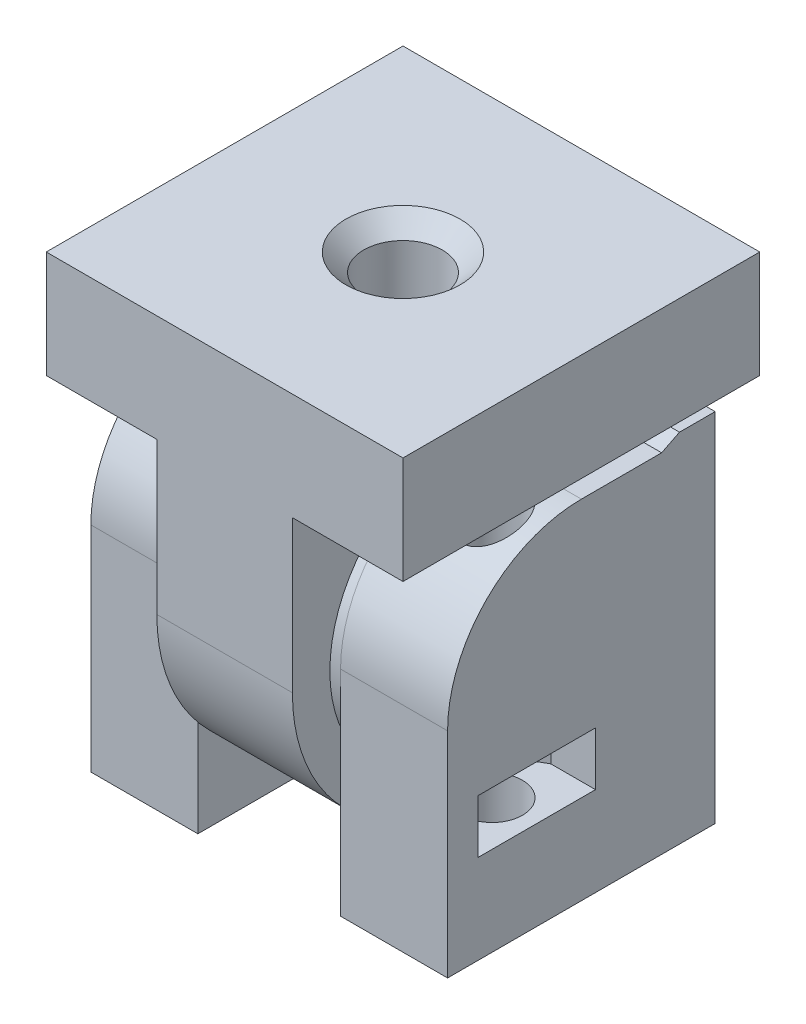
from build123d import *

# Parameters (mm, degrees)
SKETCH1_R           = 7.5
BOSS_EXTRUDE1_DEPTH = 20
SKETCH2_W           = 15
SKETCH2_H           = 19.5
BOSS_EXTRUDE2_DEPTH = 6
FILLET1_R           = 7.5
FILLET2_R           = 7.5
BOSS_EXTRUDE3_START = 0.2
BOSS_EXTRUDE3_DEPTH = 7.6
SKETCH6_W           = 20
SKETCH6_H           = 6
BOSS_EXTRUDE4_DEPTH = 6.2
SKETCH7_W           = 20
SKETCH7_H           = 6
BOSS_EXTRUDE5_DEPTH = 6.2
SKETCH10_R          = 2.2
CUT_EXTRUDE6_DEPTH  = 7
CHAMFER2_SIZE       = 1
SKETCH11_R          = 1.7
CUT_EXTRUDE7_DEPTH  = 20
CUT_EXTRUDE8_START  = -5
SKETCH12_R          = 1.7
CUT_EXTRUDE8_DEPTH  = 3
BOSS_EXTRUDE6_DEPTH = 6
BOSS_EXTRUDE7_DEPTH = 6


with BuildPart() as part:
    # Sketch1 → Boss-Extrude1 (new body)
    with BuildSketch(Plane(origin=(0, 0, 0), x_dir=(0, 0, -1), z_dir=(1, 0, 0))):
        Circle(SKETCH1_R)
    extrude(amount=BOSS_EXTRUDE1_DEPTH)

    # Sketch2 → Boss-Extrude2 (add)
    with BuildSketch(Plane(origin=(20, 0, 0), x_dir=(0, 0, -1), z_dir=(1, 0, 0))):
        with Locations((0, -2.25)):
            Rectangle(SKETCH2_W, SKETCH2_H)
    boss_extrude2 = extrude(amount=-BOSS_EXTRUDE2_DEPTH)

    # Fillet1
    fillet1_edges = [part.edges().sort_by_distance(p)[0] for p in [
        (17, 7.5, 7.5),
    ]]
    fillet(fillet1_edges, radius=FILLET1_R)

    # Mirror2: Boss-Extrude2 across plane
    add(boss_extrude2.mirror(Plane.ZY.offset(-10)))

    # Fillet2
    fillet2_edges = [part.edges().sort_by_distance(p)[0] for p in [
        (3, 7.5, 7.5),
    ]]
    fillet(fillet2_edges, radius=FILLET2_R)

    # Sketch11 → Cut-Extrude7 (cut)
    with BuildSketch(Plane(origin=(0, -12, 0), x_dir=(-1, 0, 0), z_dir=(0, -1, 0))):
        with Locations(Location((-2.5, -2.5, 0), (0, 0, 90))):
            Circle(SKETCH11_R)
        with Locations(Location((-17.5, -2.5, 0), (0, 0, 90))):
            Circle(SKETCH11_R)
    extrude(amount=-CUT_EXTRUDE7_DEPTH, mode=Mode.SUBTRACT)

    # Sketch12 → Cut-Extrude8 (cut)
    # profile 1 of 7: a face of its own
    with BuildSketch(Plane(origin=(0, -12, 0), x_dir=(-1, 0, 0), z_dir=(0, -1, 0)).offset(CUT_EXTRUDE8_START)):
        Polygon((0, -0.652479139), (-2.5, 0.790896534), (-5.35, -0.854551733), (-5.35, -4.145448267), (-2.5, -5.790896534), (0, -4.347520861), align=None)
        with Locations(Location((-2.5, -2.5, 0), (0, 0, 90))):
            Circle(SKETCH12_R, mode=Mode.SUBTRACT)
    # profile 2 of 7: a face of its own
    with BuildSketch(Plane(origin=(0, -12, 0), x_dir=(-1, 0, 0), z_dir=(0, -1, 0)).offset(CUT_EXTRUDE8_START)):
        with Locations(Location((-2.5, -2.5, 0), (0, 0, 90))):
            Circle(SKETCH12_R)
    # profile 3 of 7: a face of its own
    with BuildSketch(Plane(origin=(0, -12, 0), x_dir=(-1, 0, 0), z_dir=(0, -1, 0)).offset(CUT_EXTRUDE8_START)):
        Polygon((0, -5.790896534), (0, -4.347520861), (-2.5, -5.790896534), align=None)
    # profile 4 of 7: a face of its own
    with BuildSketch(Plane(origin=(0, -12, 0), x_dir=(-1, 0, 0), z_dir=(0, -1, 0)).offset(CUT_EXTRUDE8_START)):
        Polygon((0, -0.652479139), (0, 0.790896534), (-2.5, 0.790896534), align=None)
    # profile 5 of 7: a face of its own
    with BuildSketch(Plane(origin=(0, -12, 0), x_dir=(-1, 0, 0), z_dir=(0, -1, 0)).offset(CUT_EXTRUDE8_START)):
        Polygon((-20, -4.347520861), (-17.5, -5.790896534), (-14.65, -4.145448267), (-14.65, -0.854551733), (-17.5, 0.790896534), (-20, -0.652479139), align=None)
    # profile 6 of 7: a face of its own
    with BuildSketch(Plane(origin=(0, -12, 0), x_dir=(-1, 0, 0), z_dir=(0, -1, 0)).offset(CUT_EXTRUDE8_START)):
        Polygon((-20, -5.790896534), (-17.5, -5.790896534), (-20, -4.347520861), align=None)
    # profile 7 of 7: a face of its own
    with BuildSketch(Plane(origin=(0, -12, 0), x_dir=(-1, 0, 0), z_dir=(0, -1, 0)).offset(CUT_EXTRUDE8_START)):
        Polygon((-20, 0.790896534), (-20, -0.652479139), (-17.5, 0.790896534), align=None)
    extrude(amount=-CUT_EXTRUDE8_DEPTH, mode=Mode.SUBTRACT)

    # Sketch13 → Boss-Extrude6 (add)
    with BuildSketch(Plane(origin=(20, 0, 0), x_dir=(0, 0, -1), z_dir=(1, 0, 0))):
        Polygon((7.5, 7.5), (7.5, 8), (5.5, 8), (4.5, 7.5), align=None)
    extrude(amount=-BOSS_EXTRUDE6_DEPTH)

    # Sketch15 → Boss-Extrude7 (add)
    with BuildSketch(Plane.ZY):
        Polygon((-7.5, 7.5), (-7.5, 8), (-5.5, 8), (-4.5, 7.5), align=None)
    extrude(amount=-BOSS_EXTRUDE7_DEPTH)


with BuildPart() as body_2:
    # Sketch5 → Boss-Extrude3 (new body)
    with BuildSketch(Plane.ZY.offset(-14).offset(BOSS_EXTRUDE3_START)):
        with BuildLine():
            ThreePointArc((7.5, -6.614378278), (9.354143467, -3.535533906), (10, 0))
            ThreePointArc((10, 0), (0, 10), (-10, 0))
            ThreePointArc((-10, 0), (-9.354143467, -3.535533906), (-7.5, -6.614378278))
            Line((-7.5, -6.614378278), (-7.5, -2.481934729))
            ThreePointArc((-7.5, -2.481934729), (-1.256980509, 7.799358948), (7.9, 0))
            ThreePointArc((7.9, 0), (7.799358948, -1.256980509), (7.5, -2.481934729))
            Line((7.5, -2.481934729), (7.5, -6.614378278))
        make_face()
        with BuildLine():
            ThreePointArc((-7.5, -6.614378278), (0, -10), (7.5, -6.614378278))
            Line((7.5, -6.614378278), (7.5, -2.481934729))
            ThreePointArc((7.5, -2.481934729), (0, -7.9), (-7.5, -2.481934729))
            Line((-7.5, -2.481934729), (-7.5, -6.614378278))
        make_face()
        with BuildLine():
            ThreePointArc((-10, 0), (0, 10), (10, 0))
            Line((10, 0), (10, 14.5))
            Line((10, 14.5), (-10, 14.5))
            Line((-10, 14.5), (-10, 0))
        make_face()
    extrude(amount=BOSS_EXTRUDE3_DEPTH)

    # Sketch6 → Boss-Extrude4 (add)
    with BuildSketch(Plane.ZY.offset(-6.2)):
        with Locations((0, 11.5)):
            Rectangle(SKETCH6_W, SKETCH6_H)
    extrude(amount=BOSS_EXTRUDE4_DEPTH)

    # Sketch7 → Boss-Extrude5 (add)
    with BuildSketch(Plane(origin=(13.8, 0, 0), x_dir=(0, 0, -1), z_dir=(1, 0, 0))):
        with Locations((0, 11.5)):
            Rectangle(SKETCH7_W, SKETCH7_H)
    extrude(amount=BOSS_EXTRUDE5_DEPTH)

    # Sketch10 → Cut-Extrude6 (cut)
    with BuildSketch(Plane(origin=(0, 14.5, 0), x_dir=(1, 0, 0), z_dir=(0, 1, 0))):
        with Locations(Location((10, 0, 0), (0, 0, 270))):
            Circle(SKETCH10_R)
    extrude(amount=-CUT_EXTRUDE6_DEPTH, mode=Mode.SUBTRACT)

    # Chamfer2
    chamfer2_edges = [body_2.edges().sort_by_distance(p)[0] for p in [
        (10, 14.5, -2.2),
    ]]
    chamfer(chamfer2_edges, length=CHAMFER2_SIZE)


solid = Compound([part.part, body_2.part])
